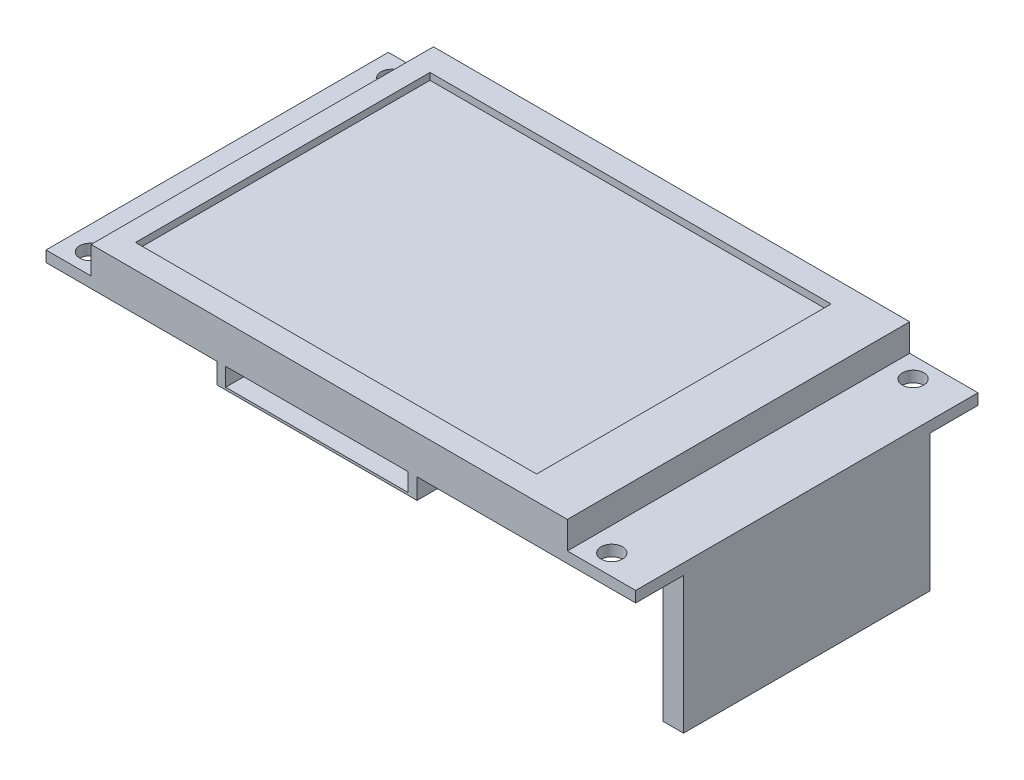
from build123d import *

# Parameters (mm, degrees)
SKETCH1_W          = 86.3
SKETCH1_H          = 50.1
CIRCUIT_DEPTH      = 1.6
SKETCH2_R          = 1.57
SCREW_HOLES_DEPTH  = 50.919785657
SKETCH3_W          = 69.7
SKETCH3_H          = 50.1
LCD_DEPTH          = 4
SKETCH4_W          = 3
SKETCH4_H          = 36.1
PINS_DEPTH         = 20
SKETCH6_W          = 29.3
SKETCH6_H          = 20
SD_SLOT_DEPTH      = 3
SKETCH8_W          = 26.7
SKETCH8_H          = 2.65
CUT_EXTRUDE2_DEPTH = 5
SKETCH9_W          = 58.7
SKETCH9_H          = 43.1
CUT_EXTRUDE3_DEPTH = 1


with BuildPart() as part:
    # Sketch1 → CIRCUIT (new body)
    with BuildSketch(Plane(origin=(0, 0, 0), x_dir=(1, 0, 0), z_dir=(0, 1, 0))):
        Rectangle(SKETCH1_W, SKETCH1_H)
    extrude(amount=CIRCUIT_DEPTH)

    # Sketch2 → SCREW_HOLES (cut, through all)
    with BuildSketch(Plane(origin=(0, 1.6, 0), x_dir=(1, 0, 0), z_dir=(0, 1, 0))):
        with Locations(Location((-39.65, 22.05, 0), (0, 0, 270))):
            Circle(SKETCH2_R)
        with Locations(Location((-39.65, -22.05, 0), (0, 0, 270))):
            Circle(SKETCH2_R)
        with Locations(Location((36.65, 22.05, 0), (0, 0, 270))):
            Circle(SKETCH2_R)
        with Locations(Location((36.65, -22.05, 0), (0, 0, 270))):
            Circle(SKETCH2_R)
    extrude(amount=-SCREW_HOLES_DEPTH, mode=Mode.SUBTRACT)

    # Sketch3 → LCD (add)
    with BuildSketch(Plane(origin=(0, 1.6, 0), x_dir=(1, 0, 0), z_dir=(0, 1, 0))):
        with Locations((-1.7, 0)):
            Rectangle(SKETCH3_W, SKETCH3_H)
    extrude(amount=LCD_DEPTH)

    # Sketch4 → PINS (add)
    with BuildSketch(Plane.XZ):
        with Locations((41.65, 0)):
            Rectangle(SKETCH4_W, SKETCH4_H)
    extrude(amount=PINS_DEPTH)

    # Sketch6 → SD_SLOT (add)
    with BuildSketch(Plane.XZ):
        with Locations((-3.5, 15.05)):
            Rectangle(SKETCH6_W, SKETCH6_H)
    extrude(amount=SD_SLOT_DEPTH)

    # Sketch8 → Cut-Extrude2 (cut)
    with BuildSketch(Plane.XY.offset(25.05)):
        with Locations((-3.5, -1.325)):
            Rectangle(SKETCH8_W, SKETCH8_H)
    extrude(amount=-CUT_EXTRUDE2_DEPTH, mode=Mode.SUBTRACT)

    # Sketch9 → Cut-Extrude3 (cut)
    with BuildSketch(Plane(origin=(0, 5.6, 0), x_dir=(1, 0, 0), z_dir=(0, 1, 0))):
        with Locations((-4.2, 0)):
            Rectangle(SKETCH9_W, SKETCH9_H)
    extrude(amount=-CUT_EXTRUDE3_DEPTH, mode=Mode.SUBTRACT)


solid = part.part
